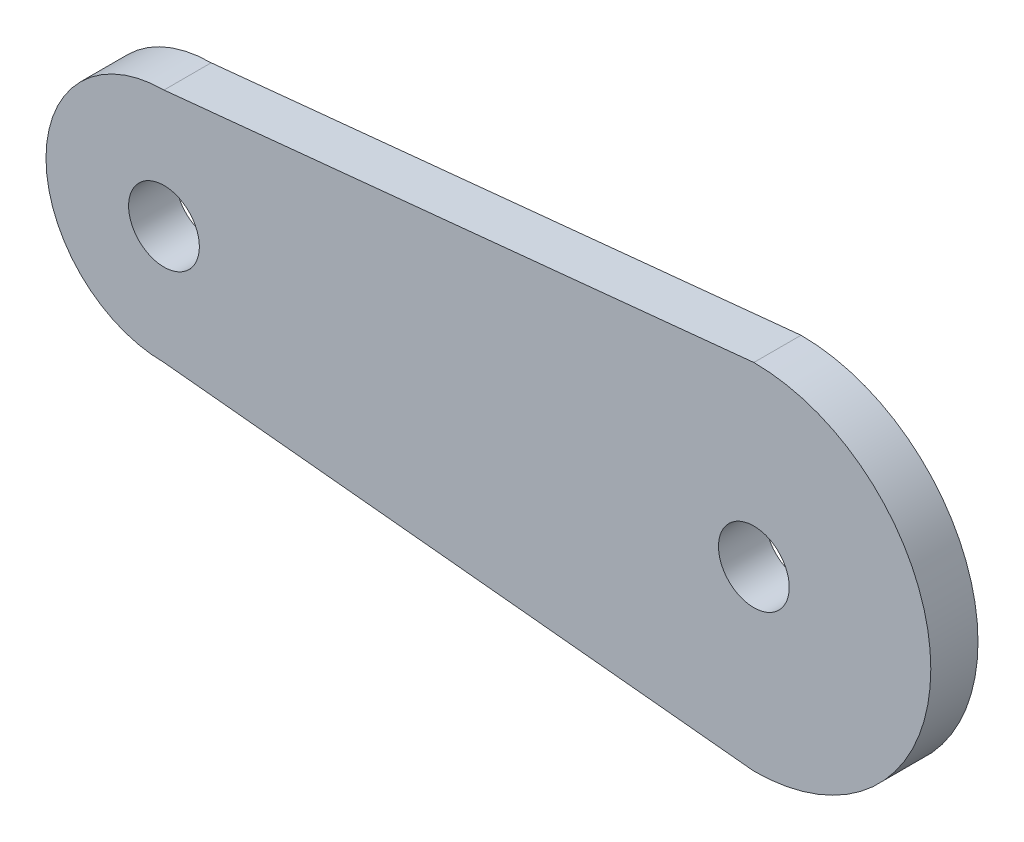
from build123d import *

# Parameters (mm, degrees)
SKETCH1_R           = 1.5
BOSS_EXTRUDE1_DEPTH = 2


with BuildPart() as part:
    # Sketch1 → Boss-Extrude1 (new body)
    with BuildSketch(Plane.XY):
        with BuildLine():
            Line((0, 0), (25, 2.5))
            ThreePointArc((25, 2.5), (32.5, -5), (25, -12.5))
            Line((25, -12.5), (0, -10))
            ThreePointArc((0, -10), (-5, -5), (0, 0))
        make_face()
        with Locations((0, -5)):
            Circle(SKETCH1_R, mode=Mode.SUBTRACT)
        with Locations((25, -5)):
            Circle(SKETCH1_R, mode=Mode.SUBTRACT)
    extrude(amount=BOSS_EXTRUDE1_DEPTH)


solid = part.part
